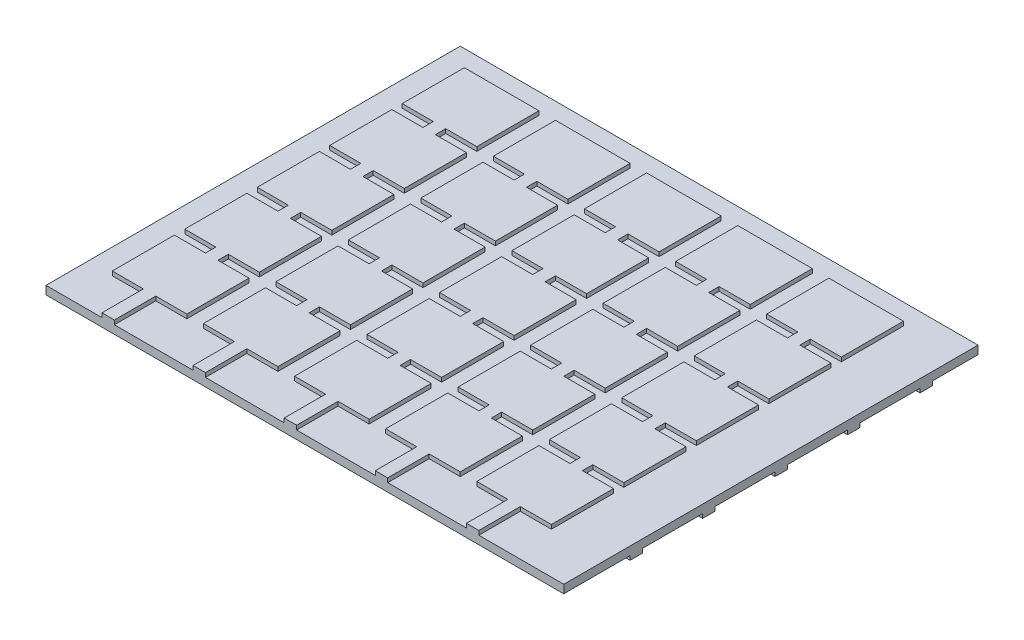
from build123d import *

# Parameters (mm, degrees)
SKETCH1_W           = 125
SKETCH1_H           = 100
BOSS_EXTRUDE1_DEPTH = 2
BOSS_EXTRUDE2_DEPTH = 1
BOSS_EXTRUDE3_DEPTH = 1


with BuildPart() as part:
    # Sketch1 → Boss-Extrude1 (new body)
    with BuildSketch(Plane(origin=(0, 0, 0), x_dir=(1, 0, 0), z_dir=(0, 1, 0))):
        Rectangle(SKETCH1_W, SKETCH1_H)
    extrude(amount=BOSS_EXTRUDE1_DEPTH)

    # Sketch2 → Boss-Extrude2 (add)
    with BuildSketch(Plane(origin=(0, 2, 0), x_dir=(1, 0, 0), z_dir=(0, 1, 0))):
        Polygon((-56.5, 45), (-38.5, 45), (-38.5, 30), (-46, 30), (-46, 27.5), (-38.5, 27.5), (-38.5, 12.5), (-46, 12.5), (-46, 10), (-38.5, 10), (-38.5, -5), (-46, -5), (-46, -7.5), (-38.5, -7.5), (-38.5, -22.5), (-46, -22.5), (-46, -25), (-38.5, -25), (-38.5, -40), (-46, -40), (-46, -50), (-49, -50), (-49, -40), (-56.5, -40), (-56.5, -25), (-49, -25), (-49, -22.5), (-56.5, -22.5), (-56.5, -7.5), (-49, -7.5), (-49, -5), (-56.5, -5), (-56.5, 10), (-49, 10), (-49, 12.5), (-56.5, 12.5), (-56.5, 27.5), (-49, 27.5), (-49, 30), (-56.5, 30), align=None)
        Polygon((-34.5, 45), (-34.5, 30), (-27, 30), (-27, 27.5), (-34.5, 27.5), (-34.5, 12.5), (-27, 12.5), (-27, 10), (-34.5, 10), (-34.5, -5), (-27, -5), (-27, -7.5), (-34.5, -7.5), (-34.5, -22.5), (-27, -22.5), (-27, -25), (-34.5, -25), (-34.5, -40), (-27, -40), (-27, -50), (-24, -50), (-24, -40), (-16.5, -40), (-16.5, -25), (-24, -25), (-24, -22.5), (-16.5, -22.5), (-16.5, -7.5), (-24, -7.5), (-24, -5), (-16.5, -5), (-16.5, 10), (-24, 10), (-24, 12.5), (-16.5, 12.5), (-16.5, 27.5), (-24, 27.5), (-24, 30), (-16.5, 30), (-16.5, 45), align=None)
        Polygon((-12.5, 45), (-12.5, 30), (-5, 30), (-5, 27.5), (-12.5, 27.5), (-12.5, 12.5), (-5, 12.5), (-5, 10), (-12.5, 10), (-12.5, -5), (-5, -5), (-5, -7.5), (-12.5, -7.5), (-12.5, -22.5), (-5, -22.5), (-5, -25), (-12.5, -25), (-12.5, -40), (-5, -40), (-5, -50), (-2, -50), (-2, -40), (5.5, -40), (5.5, -25), (-2, -25), (-2, -22.5), (5.5, -22.5), (5.5, -7.5), (-2, -7.5), (-2, -5), (5.5, -5), (5.5, 10), (-2, 10), (-2, 12.5), (5.5, 12.5), (5.5, 27.5), (-2, 27.5), (-2, 30), (5.5, 30), (5.5, 45), align=None)
        Polygon((9.5, 45), (9.5, 30), (17, 30), (17, 27.5), (9.5, 27.5), (9.5, 12.5), (17, 12.5), (17, 10), (9.5, 10), (9.5, -5), (17, -5), (17, -7.5), (9.5, -7.5), (9.5, -22.5), (17, -22.5), (17, -25), (9.5, -25), (9.5, -40), (17, -40), (17, -50), (20, -50), (20, -40), (27.5, -40), (27.5, -25), (20, -25), (20, -22.5), (27.5, -22.5), (27.5, -7.5), (20, -7.5), (20, -5), (27.5, -5), (27.5, 10), (20, 10), (20, 12.5), (27.5, 12.5), (27.5, 27.5), (20, 27.5), (20, 30), (27.5, 30), (27.5, 45), align=None)
        Polygon((31.5, 45), (31.5, 30), (39, 30), (39, 27.5), (31.5, 27.5), (31.5, 12.5), (39, 12.5), (39, 10), (31.5, 10), (31.5, -5), (39, -5), (39, -7.5), (31.5, -7.5), (31.5, -22.5), (39, -22.5), (39, -25), (31.5, -25), (31.5, -40), (39, -40), (39, -50), (42, -50), (42, -40), (49.5, -40), (49.5, -25), (42, -25), (42, -22.5), (49.5, -22.5), (49.5, -7.5), (42, -7.5), (42, -5), (49.5, -5), (49.5, 10), (42, 10), (42, 12.5), (49.5, 12.5), (49.5, 27.5), (42, 27.5), (42, 30), (49.5, 30), (49.5, 45), align=None)
    extrude(amount=BOSS_EXTRUDE2_DEPTH)

    # Sketch3 → Boss-Extrude3 (add)
    with BuildSketch(Plane.XZ):
        Polygon((-38.5, 40), (-38.5, 34), (-34.5, 34), (-34.5, 40), (-16.5, 40), (-16.5, 34), (-12.5, 34), (-12.5, 40), (5.5, 40), (5.5, 34), (9.5, 34), (9.5, 40), (27.5, 40), (27.5, 34), (31.5, 34), (31.5, 40), (49.5, 40), (49.5, 34), (62.5, 34), (62.5, 31), (49.5, 31), (49.5, 25), (31.5, 25), (31.5, 31), (27.5, 31), (27.5, 25), (9.5, 25), (9.5, 31), (5.5, 31), (5.5, 25), (-12.5, 25), (-12.5, 31), (-16.5, 31), (-16.5, 25), (-34.5, 25), (-34.5, 31), (-38.5, 31), (-38.5, 25), (-56.5, 25), (-56.5, 40), align=None)
        Polygon((-56.5, -45), (-38.5, -45), (-38.5, -39), (-34.5, -39), (-34.5, -45), (-16.5, -45), (-16.5, -39), (-12.5, -39), (-12.5, -45), (5.5, -45), (5.5, -39), (9.5, -39), (9.5, -45), (27.5, -45), (27.5, -39), (31.5, -39), (31.5, -45), (49.5, -45), (49.5, -39), (62.5, -39), (62.5, -36), (49.5, -36), (49.5, -30), (31.5, -30), (31.5, -36), (27.5, -36), (27.5, -30), (9.5, -30), (9.5, -36), (5.5, -36), (5.5, -30), (-12.5, -30), (-12.5, -36), (-16.5, -36), (-16.5, -30), (-34.5, -30), (-34.5, -36), (-38.5, -36), (-38.5, -30), (-56.5, -30), align=None)
        Polygon((-56.5, 22.5), (-38.5, 22.5), (-38.5, 16.5), (-34.5, 16.5), (-34.5, 22.5), (-16.5, 22.5), (-16.5, 16.5), (-12.5, 16.5), (-12.5, 22.5), (5.5, 22.5), (5.5, 16.5), (9.5, 16.5), (9.5, 22.5), (27.5, 22.5), (27.5, 16.5), (31.5, 16.5), (31.5, 22.5), (49.5, 22.5), (49.5, 16.5), (62.5, 16.5), (62.5, 13.5), (49.5, 13.5), (49.5, 7.5), (31.5, 7.5), (31.5, 13.5), (27.5, 13.5), (27.5, 7.5), (9.5, 7.5), (9.5, 13.5), (5.5, 13.5), (5.5, 7.5), (-12.5, 7.5), (-12.5, 13.5), (-16.5, 13.5), (-16.5, 7.5), (-34.5, 7.5), (-34.5, 13.5), (-38.5, 13.5), (-38.5, 7.5), (-56.5, 7.5), align=None)
        Polygon((-56.5, 5), (-38.5, 5), (-38.5, -1), (-34.5, -1), (-34.5, 5), (-16.5, 5), (-16.5, -1), (-12.5, -1), (-12.5, 5), (5.5, 5), (5.5, -1), (9.5, -1), (9.5, 5), (27.5, 5), (27.5, -1), (31.5, -1), (31.5, 5), (49.5, 5), (49.5, -1), (62.5, -1), (62.5, -4), (49.5, -4), (49.5, -10), (31.5, -10), (31.5, -4), (27.5, -4), (27.5, -10), (9.5, -10), (9.5, -4), (5.5, -4), (5.5, -10), (-12.5, -10), (-12.5, -4), (-16.5, -4), (-16.5, -10), (-34.5, -10), (-34.5, -4), (-38.5, -4), (-38.5, -10), (-56.5, -10), align=None)
        Polygon((49.5, -12.5), (31.5, -12.5), (31.5, -18.5), (27.5, -18.5), (27.5, -12.5), (9.5, -12.5), (9.5, -18.5), (5.5, -18.5), (5.5, -12.5), (-12.5, -12.5), (-12.5, -18.5), (-16.5, -18.5), (-16.5, -12.5), (-34.5, -12.5), (-34.5, -18.5), (-38.5, -18.5), (-38.5, -12.5), (-56.5, -12.5), (-56.5, -27.5), (-38.5, -27.5), (-38.5, -21.5), (-34.5, -21.5), (-34.5, -27.5), (-16.5, -27.5), (-16.5, -21.5), (-12.5, -21.5), (-12.5, -27.5), (5.5, -27.5), (5.5, -21.5), (9.5, -21.5), (9.5, -27.5), (27.5, -27.5), (27.5, -21.5), (31.5, -21.5), (31.5, -27.5), (49.5, -27.5), (49.5, -21.5), (62.5, -21.5), (62.5, -18.5), (49.5, -18.5), align=None)
    extrude(amount=BOSS_EXTRUDE3_DEPTH)


solid = part.part
